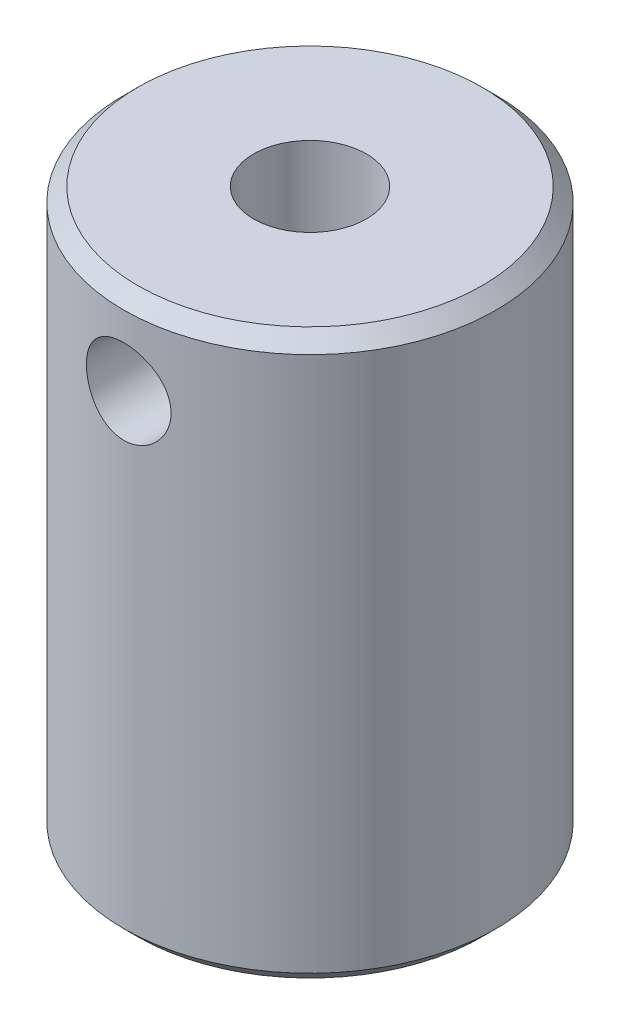
from build123d import *

# Parameters (mm, degrees)
EXTRUDE_1_DEPTH      = 18.8
EXTRUDE_1_DEPTH_BACK = 1.2
SKETCH_1_R           = 6.6
CHAMFER_1_SIZE       = 0.5
SKETCH_2_R           = 2
CUT_EXTRUDE_1_DEPTH  = 13.4
SKETCH_3_R           = 1.5
CUT_EXTRUDE_2_DEPTH  = 13.4


with BuildPart() as part:
    # 草图1 → 凸台-拉伸1 (new, two sides: drawn at the far end of the back side and taken through both)
    with BuildSketch(Plane(origin=(0, 0, 0), x_dir=(1, 0, 0), z_dir=(0, 1, 0)).offset(-EXTRUDE_1_DEPTH_BACK)):
        with Locations(Location((0, 0, 0), (0, 0, 270))):
            Circle(SKETCH_1_R)
    extrude(amount=EXTRUDE_1_DEPTH + EXTRUDE_1_DEPTH_BACK)

    # 倒角1
    chamfer_1_edges = [part.edges().sort_by_distance(p)[0] for p in [
        (0, -1.2, -6.6),
        (0, 18.8, -6.6),
    ]]
    chamfer(chamfer_1_edges, length=CHAMFER_1_SIZE)

    # 草图2 → 切除-拉伸1 (cut)
    with BuildSketch(Plane(origin=(0, 18.8, 0), x_dir=(1, 0, 0), z_dir=(0, 1, 0))):
        with Locations(Location((0, 0, 0), (0, 0, 270))):
            Circle(SKETCH_2_R)
    extrude(amount=-CUT_EXTRUDE_1_DEPTH, mode=Mode.SUBTRACT)

    # 草图3 → 切除-拉伸2 (cut)
    with BuildSketch(Plane.XY):
        with Locations(Location((0, 15.8, 0), (0, 0, 90))):
            Circle(SKETCH_3_R)
    extrude(amount=CUT_EXTRUDE_2_DEPTH, mode=Mode.SUBTRACT)


solid = part.part
